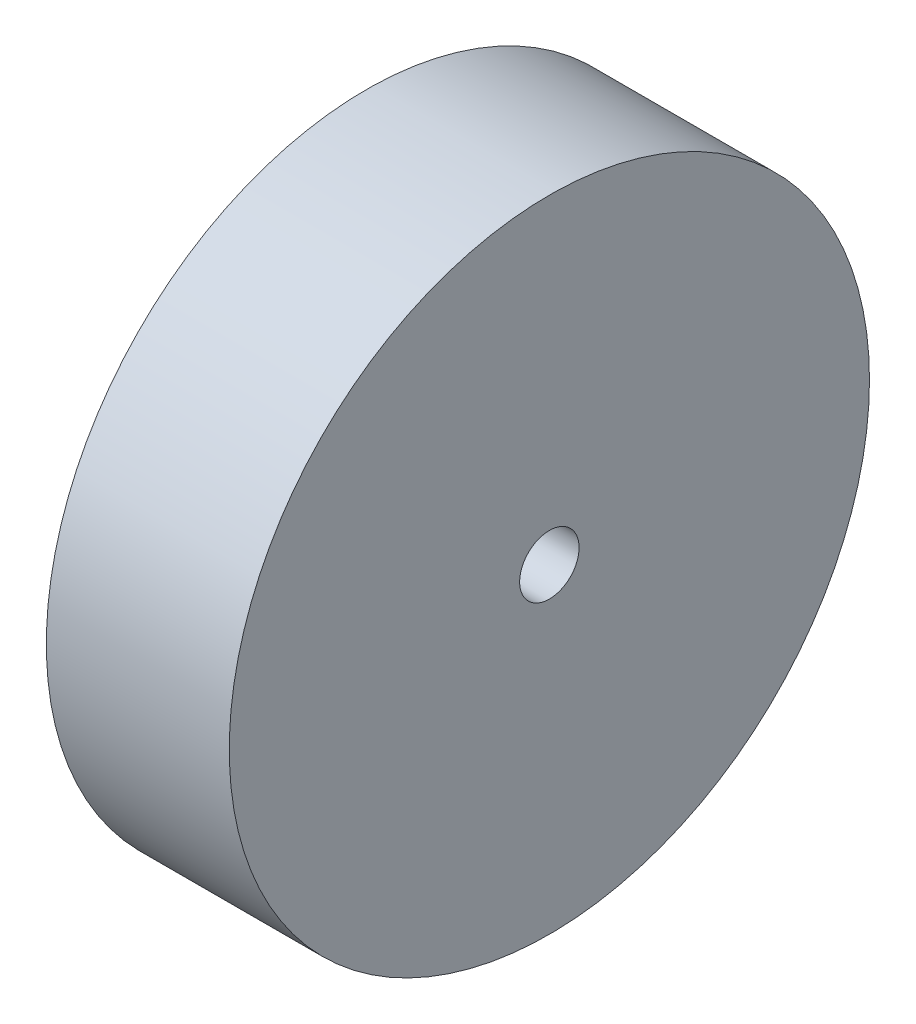
from build123d import *

# Parameters (mm, degrees)
EXTRUDE_1_DEPTH      = 10
EXTRUDE_1_DEPTH_BACK = 10
SKETCH_1_R           = 35
SKETCH_1_R_2         = 3.25


with BuildPart() as part:
    # 스케치1 → 보스-돌출1 (new, two sides: drawn at the far end of the back side and taken through both)
    with BuildSketch(Plane(origin=(106.66450597, 0, 0), x_dir=(0, 0, -1), z_dir=(1, 0, 0)).offset(-EXTRUDE_1_DEPTH_BACK)):
        with Locations((-20.05989737, 49.939120705)):
            Circle(SKETCH_1_R)
        with Locations((-20.05989737, 49.939120705)):
            Circle(SKETCH_1_R_2, mode=Mode.SUBTRACT)
    extrude(amount=EXTRUDE_1_DEPTH + EXTRUDE_1_DEPTH_BACK)


solid = part.part
